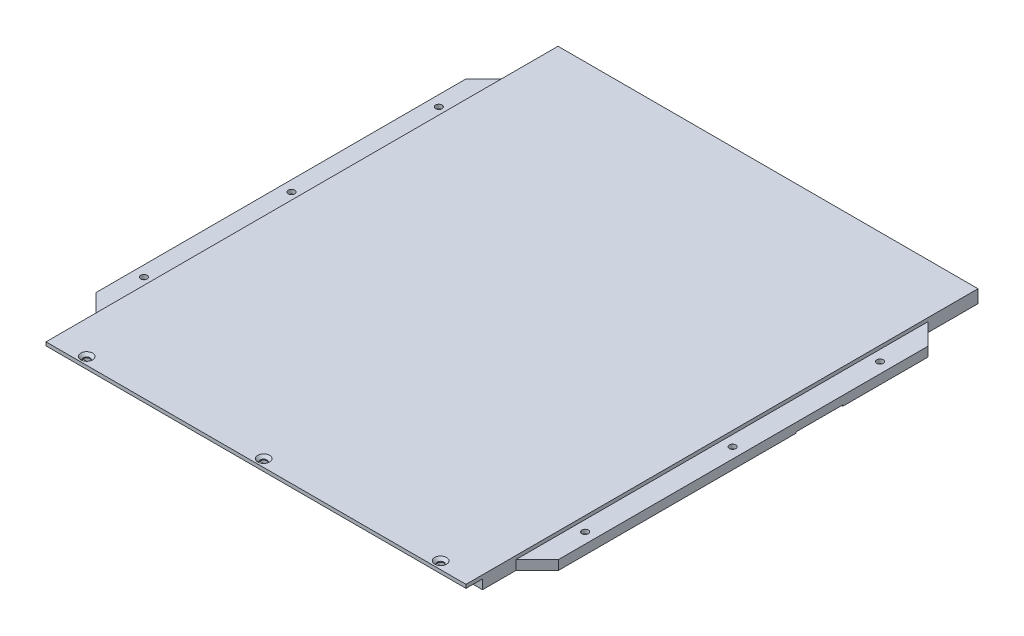
from build123d import *

# Parameters (mm, degrees)
SKETCH1_W           = 142.4
SKETCH1_H           = 173.6
BOSS_EXTRUDE1_DEPTH = 4.4
SKETCH2_W           = 142.4
SKETCH2_H           = 5.6
CUT_EXTRUDE1_DEPTH  = 3.2
CUT_EXTRUDE2_REACH  = 114.352
SKETCH3_R           = 1.1
SKETCH4_R           = 0.9
CUT_EXTRUDE3_DEPTH  = 9
CHAMFER2_SIZE       = 0.9
BOSS_EXTRUDE2_DEPTH = 3.2
SKETCH6_R           = 1.1
CUT_EXTRUDE4_DEPTH  = 118.047682591
CUT_EXTRUDE5_DEPTH  = 1.8
CUT_EXTRUDE6_DEPTH  = 0.4


with BuildPart() as part:
    # Sketch1 → Boss-Extrude1 (new body)
    with BuildSketch(Plane(origin=(0, 0, 0), x_dir=(1, 0, 0), z_dir=(0, 1, 0))):
        Rectangle(SKETCH1_W, SKETCH1_H)
    extrude(amount=-BOSS_EXTRUDE1_DEPTH)

    # Sketch2 → Cut-Extrude1 (cut)
    with BuildSketch(Plane.XZ.offset(4.4)):
        with Locations((0, 84)):
            Rectangle(SKETCH2_W, SKETCH2_H)
    extrude(amount=-CUT_EXTRUDE1_DEPTH, mode=Mode.SUBTRACT)

    # Sketch3 → Cut-Extrude2 (cut, up to next)
    with BuildSketch(Plane(origin=(0, 0, 0), x_dir=(1, 0, 0), z_dir=(0, 1, 0)), mode=Mode.PRIVATE) as cut_extrude2_sk1:
        with Locations(Location((60, -84.2, 0), (0, 0, 270))):
            Circle(SKETCH3_R)
    cut_extrude2_tool1 = extrude(cut_extrude2_sk1.sketch, amount=-CUT_EXTRUDE2_REACH, mode=Mode.PRIVATE) & part.part
    # Sketch3 → Cut-Extrude2 (cut, up to next)
    with BuildSketch(Plane(origin=(0, 0, 0), x_dir=(1, 0, 0), z_dir=(0, 1, 0)), mode=Mode.PRIVATE) as cut_extrude2_sk2:
        with Locations(Location((-60, -84.2, 0), (0, 0, 270))):
            Circle(SKETCH3_R)
    cut_extrude2_tool2 = extrude(cut_extrude2_sk2.sketch, amount=-CUT_EXTRUDE2_REACH, mode=Mode.PRIVATE) & part.part
    # Sketch3 → Cut-Extrude2 (cut, up to next)
    with BuildSketch(Plane(origin=(0, 0, 0), x_dir=(1, 0, 0), z_dir=(0, 1, 0)), mode=Mode.PRIVATE) as cut_extrude2_sk3:
        with Locations(Location((0, -84.2, 0), (0, 0, 270))):
            Circle(SKETCH3_R)
    cut_extrude2_tool3 = extrude(cut_extrude2_sk3.sketch, amount=-CUT_EXTRUDE2_REACH, mode=Mode.PRIVATE) & part.part
    add(cut_extrude2_tool1.solids().sort_by_distance((60, 0, 84.2))[0], mode=Mode.SUBTRACT)
    add(cut_extrude2_tool2.solids().sort_by_distance((-60, 0, 84.2))[0], mode=Mode.SUBTRACT)
    add(cut_extrude2_tool3.solids().sort_by_distance((0, 0, 84.2))[0], mode=Mode.SUBTRACT)

    # Sketch4 → Cut-Extrude3 (cut)
    with BuildSketch(Plane(origin=(0, 0, -86.8), x_dir=(-1, 0, 0), z_dir=(0, 0, -1))):
        with Locations((0, -2.2)):
            Circle(SKETCH4_R)
        with Locations((60, -2.2)):
            Circle(SKETCH4_R)
        with Locations((-60, -2.2)):
            Circle(SKETCH4_R)
    extrude(amount=-CUT_EXTRUDE3_DEPTH, mode=Mode.SUBTRACT)

    # Chamfer2
    chamfer2_edges = [part.edges().sort_by_distance(p)[0] for p in [
        (60, 0, 83.1),
        (-60, 0, 83.1),
        (0, 0, 83.1),
    ]]
    chamfer(chamfer2_edges, length=CHAMFER2_SIZE)

    # Sketch5 → Boss-Extrude2 (add)
    with BuildSketch(Plane.XZ.offset(4.4)):
        Polygon((-71.2, 69.858578644), (-78.4, 62.658578644), (-78.4, -62.658578644), (-71.2, -69.858578644), align=None)
        Polygon((71.2, 69.858578644), (78.4, 62.658578644), (78.4, -62.658578644), (71.2, -69.858578644), align=None)
    extrude(amount=-BOSS_EXTRUDE2_DEPTH)

    # Sketch6 → Cut-Extrude4 (cut, through all)
    with BuildSketch(Plane.XZ.offset(4.4)):
        with Locations(Location((74.8, 50, 0), (0, 0, 270))):
            Circle(SKETCH6_R)
        with Locations(Location((74.8, 0, 0), (0, 0, 270))):
            Circle(SKETCH6_R)
        with Locations(Location((74.8, -50, 0), (0, 0, 270))):
            Circle(SKETCH6_R)
        with Locations(Location((-74.8, 50, 0), (0, 0, 270))):
            Circle(SKETCH6_R)
        with Locations(Location((-74.8, 0, 0), (0, 0, 270))):
            Circle(SKETCH6_R)
        with Locations(Location((-74.8, -50, 0), (0, 0, 270))):
            Circle(SKETCH6_R)
    extrude(amount=-CUT_EXTRUDE4_DEPTH, mode=Mode.SUBTRACT)

    # Sketch7 → Cut-Extrude5 (cut)
    with BuildSketch(Plane.XZ.offset(4.4)):
        Polygon((72.4, 48.614359354), (74.8, 47.228718708), (77.2, 48.614359354), (77.2, 51.385640646), (74.8, 52.771281292), (72.4, 51.385640646), align=None)
        Polygon((77.2, 1.385640646), (74.8, 2.771281292), (72.4, 1.385640646), (72.4, -1.385640646), (74.8, -2.771281292), (77.2, -1.385640646), align=None)
        Polygon((77.2, -48.614359354), (74.8, -47.228718708), (72.4, -48.614359354), (72.4, -51.385640646), (74.8, -52.771281292), (77.2, -51.385640646), align=None)
        Polygon((-72.4, -51.385640646), (-72.4, -48.614359354), (-74.8, -47.228718708), (-77.2, -48.614359354), (-77.2, -51.385640646), (-74.8, -52.771281292), align=None)
        Polygon((-72.4, -1.385640646), (-72.4, 1.385640646), (-74.8, 2.771281292), (-77.2, 1.385640646), (-77.2, -1.385640646), (-74.8, -2.771281292), align=None)
        Polygon((-72.4, 48.614359354), (-72.4, 51.385640646), (-74.8, 52.771281292), (-77.2, 51.385640646), (-77.2, 48.614359354), (-74.8, 47.228718708), align=None)
    extrude(amount=-CUT_EXTRUDE5_DEPTH, mode=Mode.SUBTRACT)

    # Sketch8 → Cut-Extrude6 (cut)
    with BuildSketch(Plane.XZ.offset(4.4)):
        Polygon((78.4, -17.9), (-29.05, -17.9), (-44.95, -33.8), (-44.95, -86.8), (-29.05, -86.8), (-29.05, -33.8), (78.4, -33.8), align=None)
    extrude(amount=-CUT_EXTRUDE6_DEPTH, mode=Mode.SUBTRACT)


solid = part.part
